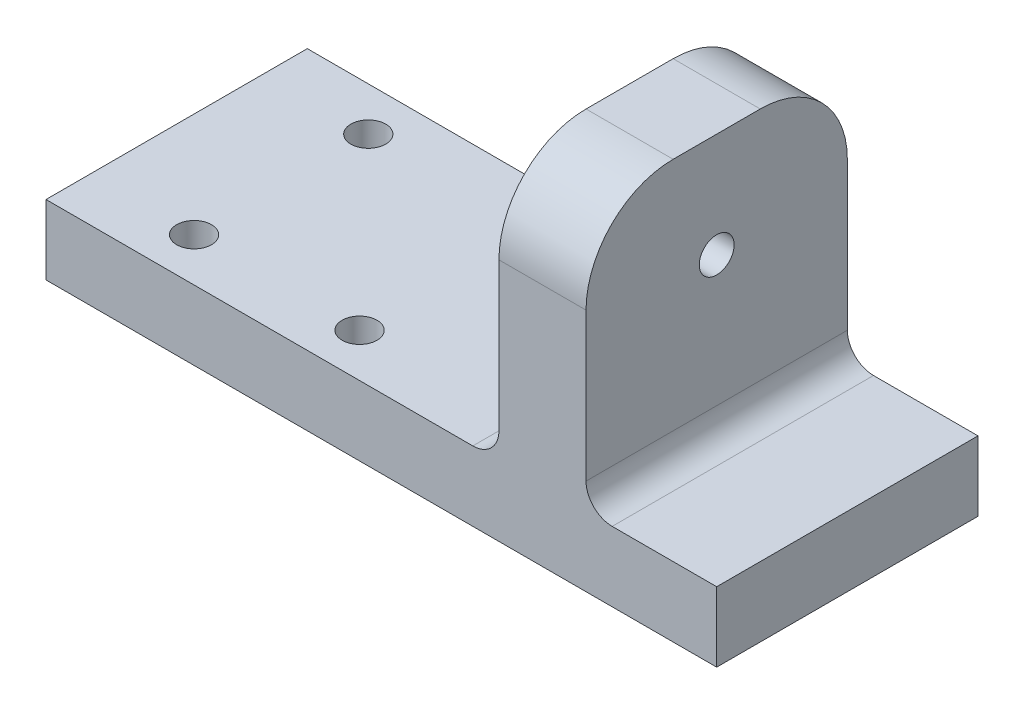
from build123d import *

# Parameters (mm, degrees)
SKETCH1_W           = 40
SKETCH1_H           = 30
BOSS_EXTRUDE1_DEPTH = 8
SKETCH2_W           = 10
SKETCH2_H           = 30
BOSS_EXTRUDE2_DEPTH = 30
FILLET2_R           = 3
SKETCH4_R           = 2
CUT_EXTRUDE2_DEPTH  = 10
FILLET3_R           = 10
SKETCH5_W           = 30
SKETCH5_H           = 8
BOSS_EXTRUDE3_DEPTH = 37
SKETCH8_R           = 2
CUT_EXTRUDE3_DEPTH  = 37


with BuildPart() as part:
    # Sketch1 → Boss-Extrude1 (new body)
    with BuildSketch(Plane(origin=(0, 0, 0), x_dir=(1, 0, 0), z_dir=(0, 1, 0))):
        Rectangle(SKETCH1_W, SKETCH1_H)
    extrude(amount=BOSS_EXTRUDE1_DEPTH)

    # Sketch2 → Boss-Extrude2 (add)
    with BuildSketch(Plane(origin=(0, 8, 0), x_dir=(1, 0, 0), z_dir=(0, 1, 0))):
        Rectangle(SKETCH2_W, SKETCH2_H)
    extrude(amount=BOSS_EXTRUDE2_DEPTH)

    # Fillet2
    fillet2_edges = [part.edges().sort_by_distance(p)[0] for p in [
        (5, 8, 0),
        (-5, 8, 0),
    ]]
    fillet(fillet2_edges, radius=FILLET2_R)

    # Sketch4 → Cut-Extrude2 (cut)
    with BuildSketch(Plane(origin=(5, 0, 0), x_dir=(0, 0, -1), z_dir=(1, 0, 0))):
        with Locations((0, 26)):
            Circle(SKETCH4_R)
    extrude(amount=-CUT_EXTRUDE2_DEPTH, mode=Mode.SUBTRACT)

    # Fillet3
    fillet3_edges = [part.edges().sort_by_distance(p)[0] for p in [
        (0, 38, -15),
        (0, 38, 15),
    ]]
    fillet(fillet3_edges, radius=FILLET3_R)

    # Sketch5 → Boss-Extrude3 (add)
    with BuildSketch(Plane.ZY.offset(20)):
        with Locations((0, 4)):
            Rectangle(SKETCH5_W, SKETCH5_H)
    extrude(amount=BOSS_EXTRUDE3_DEPTH)

    # Sketch8 → Cut-Extrude3 (cut)
    with BuildSketch(Plane(origin=(0, 8, 0), x_dir=(1, 0, 0), z_dir=(0, 1, 0))):
        with Locations(Location((-45, 10, 0), (0, 0, 270))):
            Circle(SKETCH8_R)
        with Locations(Location((-45, -10, 0), (0, 0, 270))):
            Circle(SKETCH8_R)
        with Locations(Location((-26, -10, 0), (0, 0, 270))):
            Circle(SKETCH8_R)
        with Locations(Location((-26, 10, 0), (0, 0, 270))):
            Circle(SKETCH8_R)
    extrude(amount=-CUT_EXTRUDE3_DEPTH, mode=Mode.SUBTRACT)


solid = part.part
